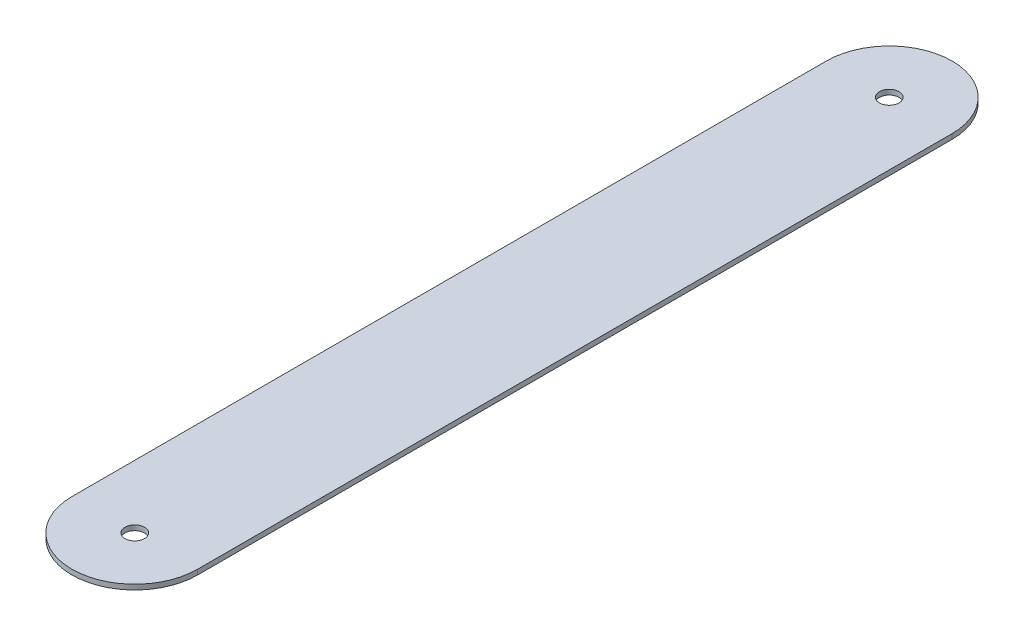
from build123d import *

# Parameters (mm, degrees)
SKETCH1_R           = 1.95
BOSS_EXTRUDE1_DEPTH = 1


with BuildPart() as part:
    # Sketch1 → Boss-Extrude1 (new body)
    with BuildSketch(Plane(origin=(0, 0, 0), x_dir=(1, 0, 0), z_dir=(0, 1, 0))):
        with BuildLine():
            Line((-12.5, 0), (-12.5, 150))
            ThreePointArc((-12.5, 150), (0, 162.5), (12.5, 150))
            Line((12.5, 150), (12.5, 0))
            ThreePointArc((12.5, 0), (0, -12.5), (-12.5, 0))
        make_face()
        with Locations(Location((0, 0, 0), (0, 0, 270))):
            Circle(SKETCH1_R, mode=Mode.SUBTRACT)
        with Locations(Location((0, 150, 0), (0, 0, 270))):
            Circle(SKETCH1_R, mode=Mode.SUBTRACT)
    extrude(amount=BOSS_EXTRUDE1_DEPTH)


solid = part.part
